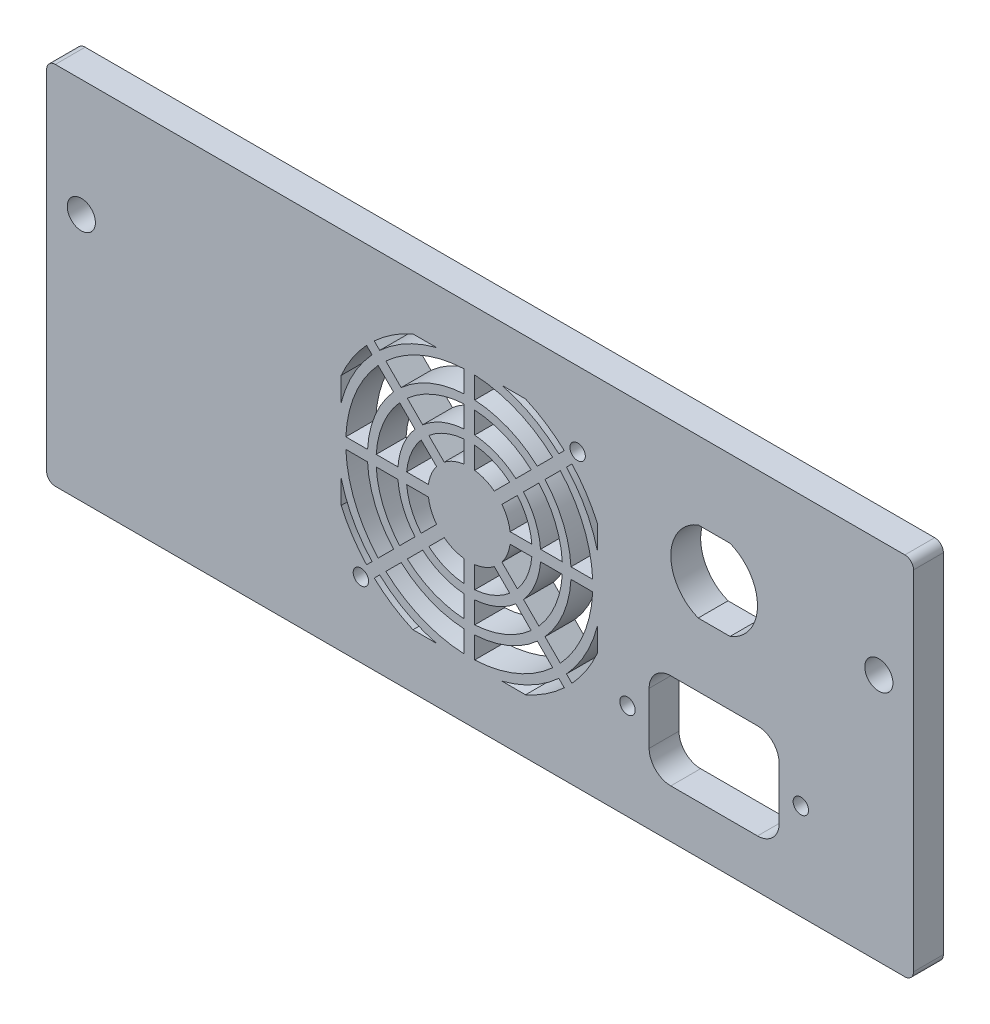
from build123d import *

# Parameters (mm, degrees)
SKETCH1_W           = 200
SKETCH1_H           = 84.3
BOSS_EXTRUDE1_DEPTH = 6.88
SKETCH2_R           = 3.25
CUT_EXTRUDE1_DEPTH  = 6.88
FILLET1_R           = 2
SKETCH3_R           = 1.775
SKETCH3_W           = 30
SKETCH3_H           = 22
CUT_EXTRUDE2_DEPTH  = 6.88
FILLET2_R           = 5
SKETCH4_R           = 1.775
SKETCH4_R_2         = 28.5
SKETCH4_R_3         = 23.5
SKETCH4_R_4         = 21.5
SKETCH4_R_5         = 16.5
SKETCH4_R_6         = 14.5
SKETCH4_R_7         = 9.5
CUT_EXTRUDE3_DEPTH  = 109.73801957
SKETCH7_W           = 2.5
SKETCH7_H           = 33
BOSS_EXTRUDE2_DEPTH = 6.88
CIRPATTERN1_COUNT   = 8


with BuildPart() as part:
    # Sketch1 → Boss-Extrude1 (new body)
    with BuildSketch(Plane.XY):
        Rectangle(SKETCH1_W, SKETCH1_H)
    extrude(amount=BOSS_EXTRUDE1_DEPTH)

    # Sketch2 → Cut-Extrude1 (cut)
    with BuildSketch(Plane.XY.offset(6.88)):
        with Locations((-92, 15.15)):
            Circle(SKETCH2_R)
        with Locations((92, 15.15)):
            Circle(SKETCH2_R)
    extrude(amount=-CUT_EXTRUDE1_DEPTH, mode=Mode.SUBTRACT)

    # Fillet1
    fillet1_edges = [part.edges().sort_by_distance(p)[0] for p in [
        (-100, 42.15, 3.44),
        (100, 42.15, 3.44),
        (100, -42.15, 3.44),
        (-100, -42.15, 3.44),
    ]]
    fillet(fillet1_edges, radius=FILLET1_R)

    # Sketch3 → Cut-Extrude2 (cut)
    with BuildSketch(Plane.XY.offset(6.88)):
        with Locations((34, -20)):
            Circle(SKETCH3_R)
        with Locations((74, -20)):
            Circle(SKETCH3_R)
        with Locations((54, -20)):
            Rectangle(SKETCH3_W, SKETCH3_H)
        with BuildLine():
            Line((50.32440481, 24.3), (57.67559519, 24.3))
            ThreePointArc((57.67559519, 24.3), (64, 15), (57.67559519, 5.7))
            Line((57.67559519, 5.7), (50.32440481, 5.7))
            ThreePointArc((50.32440481, 5.7), (44, 15), (50.32440481, 24.3))
        make_face()
    extrude(amount=-CUT_EXTRUDE2_DEPTH, mode=Mode.SUBTRACT)

    # Fillet2
    fillet2_edges = [part.edges().sort_by_distance(p)[0] for p in [
        (69, -9, 3.44),
        (69, -31, 3.44),
        (39, -31, 3.44),
        (39, -9, 3.44),
    ]]
    fillet(fillet2_edges, radius=FILLET2_R)

    # Sketch4 → Cut-Extrude3 (cut, through all)
    # profile 1 of 9: a face of its own
    with BuildSketch(Plane.XY.offset(6.88)):
        with BuildLine():
            ThreePointArc((-15.490926284, 29.55), (-25.325059318, 22.825059318), (-32.05, 12.990926284))
            Line((-32.05, 12.990926284), (-32.05, 7.552979545))
            ThreePointArc((-32.05, 7.552979545), (-24.066756826, 21.566756826), (-10.052979545, 29.55))
            Line((-10.052979545, 29.55), (-15.490926284, 29.55))
        make_face()
    # profile 2 of 9: a face of its own
    with BuildSketch(Plane.XY.offset(6.88)):
        with BuildLine():
            ThreePointArc((-10.052979545, -29.55), (-24.066756826, -21.566756826), (-32.05, -7.552979545))
            Line((-32.05, -7.552979545), (-32.05, -12.990926284))
            ThreePointArc((-32.05, -12.990926284), (-25.325059318, -22.825059318), (-15.490926284, -29.55))
            Line((-15.490926284, -29.55), (-10.052979545, -29.55))
        make_face()
    # profile 3 of 9: a face of its own
    with BuildSketch(Plane.XY.offset(6.88)):
        with BuildLine():
            Line((10.490926284, 29.55), (5.052979545, 29.55))
            ThreePointArc((5.052979545, 29.55), (19.066756826, 21.566756826), (27.05, 7.552979545))
            Line((27.05, 7.552979545), (27.05, 12.990926284))
            ThreePointArc((27.05, 12.990926284), (20.325059318, 22.825059318), (10.490926284, 29.55))
        make_face()
    # profile 4 of 9: a face of its own
    with BuildSketch(Plane.XY.offset(6.88)):
        with BuildLine():
            ThreePointArc((27.05, -7.552979545), (19.066756826, -21.566756826), (5.052979545, -29.55))
            Line((5.052979545, -29.55), (10.490926284, -29.55))
            ThreePointArc((10.490926284, -29.55), (20.325059318, -22.825059318), (27.05, -12.990926284))
            Line((27.05, -12.990926284), (27.05, -7.552979545))
        make_face()
    # profile 5 of 9: a face of its own
    with BuildSketch(Plane.XY.offset(6.88)):
        with Locations((22.5, 25)):
            Circle(SKETCH4_R)
    # profile 6 of 9: a face of its own
    with BuildSketch(Plane.XY.offset(6.88)):
        with Locations((-27.5, -25)):
            Circle(SKETCH4_R)
    # profile 7 of 9: a face of its own
    with BuildSketch(Plane.XY.offset(6.88)):
        with Locations((-2.5, 0)):
            Circle(SKETCH4_R_2)
        with Locations((-2.5, 0)):
            Circle(SKETCH4_R_3, mode=Mode.SUBTRACT)
    # profile 8 of 9: a face of its own
    with BuildSketch(Plane.XY.offset(6.88)):
        with Locations((-2.5, 0)):
            Circle(SKETCH4_R_4)
        with Locations((-2.5, 0)):
            Circle(SKETCH4_R_5, mode=Mode.SUBTRACT)
    # profile 9 of 9: a face of its own
    with BuildSketch(Plane.XY.offset(6.88)):
        with Locations((-2.5, 0)):
            Circle(SKETCH4_R_6)
        with Locations((-2.5, 0)):
            Circle(SKETCH4_R_7, mode=Mode.SUBTRACT)
    extrude(amount=-CUT_EXTRUDE3_DEPTH, mode=Mode.SUBTRACT)


with BuildPart() as cut_extrude3_piece_1:
    # of the separate pieces the step leaves, piece 1, a body of its own (cut_extrude3_pieces)
    add(part.part.solids().sort_by_distance((98, -42.15, 0))[0])



with BuildPart() as cut_extrude3_piece_2:
    # of the separate pieces the step leaves, piece 2, a body of its own (cut_extrude3_pieces)
    add(part.part.solids().sort_by_distance((7, 0, 0))[0])


with BuildPart() as cut_extrude3_piece_3:
    # of the separate pieces the step leaves, piece 3, a body of its own (cut_extrude3_pieces)
    add(part.part.solids().sort_by_distance((21, 0, 0))[0])


with BuildPart() as cut_extrude3_piece_4:
    # of the separate pieces the step leaves, piece 4, a body of its own (cut_extrude3_pieces)
    add(part.part.solids().sort_by_distance((14, 0, 0))[0])


with BuildPart() as cut_extrude3_piece_1_1:
    add(cut_extrude3_piece_1.part)

    add(cut_extrude3_piece_2.part)  # Boss-Extrude2 merges Cut-Extrude3 piece 2

    add(cut_extrude3_piece_3.part)  # Boss-Extrude2 merges Cut-Extrude3 piece 3

    add(cut_extrude3_piece_4.part)  # Boss-Extrude2 merges Cut-Extrude3 piece 4
    # Sketch7 → Boss-Extrude2 (add)
    with BuildSketch(Plane.XY.offset(6.88)):
        with Locations((-2.5, 16.5)):
            Rectangle(SKETCH7_W, SKETCH7_H)
    boss_extrude2 = extrude(amount=-BOSS_EXTRUDE2_DEPTH)

    # CirPattern1: Boss-Extrude2 ×8 about axis
    cirpattern1_axis = Axis((-2.5, 0, 0), (0, 0, 1))
    for i in range(1, CIRPATTERN1_COUNT):
        add(boss_extrude2.rotate(cirpattern1_axis, i * 360 / CIRPATTERN1_COUNT))


solid = cut_extrude3_piece_1_1.part
